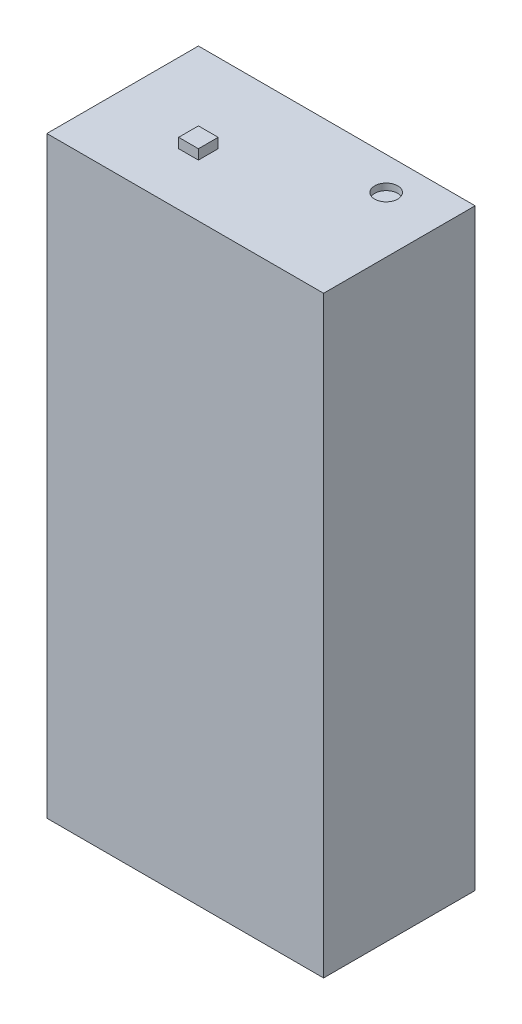
from build123d import *

# Parameters (mm, degrees)
SKETCH1_W           = 90
SKETCH1_H           = 42
BOSS_EXTRUDE1_DEPTH = 23
SKETCH1_3_R         = 2.25
CUT_EXTRUDE1_DEPTH  = 1
SKETCH2_R           = 1.75
CUT_EXTRUDE2_DEPTH  = 1
SKETCH2_3_W         = 3
SKETCH2_3_H         = 3
BOSS_EXTRUDE2_DEPTH = 1.5


with BuildPart() as part:
    # Sketch1 → Boss-Extrude1 (new body)
    with BuildSketch(Plane(origin=(0, 0, 0), x_dir=(0, 1, 0), z_dir=(0, 0, 1))):
        Rectangle(SKETCH1_W, SKETCH1_H)
    extrude(amount=BOSS_EXTRUDE1_DEPTH)

    # Sketch1<3> → Cut-Extrude1 (cut)
    with BuildSketch(Plane(origin=(0, 0, 0), x_dir=(0, 1, 0), z_dir=(0, 0, 1))):
        with Locations((-25, 12.5)):
            Circle(SKETCH1_3_R)
        with Locations((-25, -11.5)):
            Circle(SKETCH1_3_R)
        with Locations((20, -11.5)):
            Circle(SKETCH1_3_R)
        with Locations((20, 12.5)):
            Circle(SKETCH1_3_R)
    extrude(amount=CUT_EXTRUDE1_DEPTH, mode=Mode.SUBTRACT)

    # Sketch2 → Cut-Extrude2 (cut)
    with BuildSketch(Plane(origin=(0, 45, 0), x_dir=(-1, 0, 0), z_dir=(0, 1, 0))):
        with Locations((-12.5, 5)):
            Circle(SKETCH2_R)
    extrude(amount=-CUT_EXTRUDE2_DEPTH, mode=Mode.SUBTRACT)

    # Sketch2<3> → Boss-Extrude2 (add)
    with BuildSketch(Plane(origin=(0, 45, 0), x_dir=(-1, 0, 0), z_dir=(0, 1, 0))):
        with Locations((7.5, 13.5)):
            Rectangle(SKETCH2_3_W, SKETCH2_3_H)
    extrude(amount=BOSS_EXTRUDE2_DEPTH)


solid = part.part
